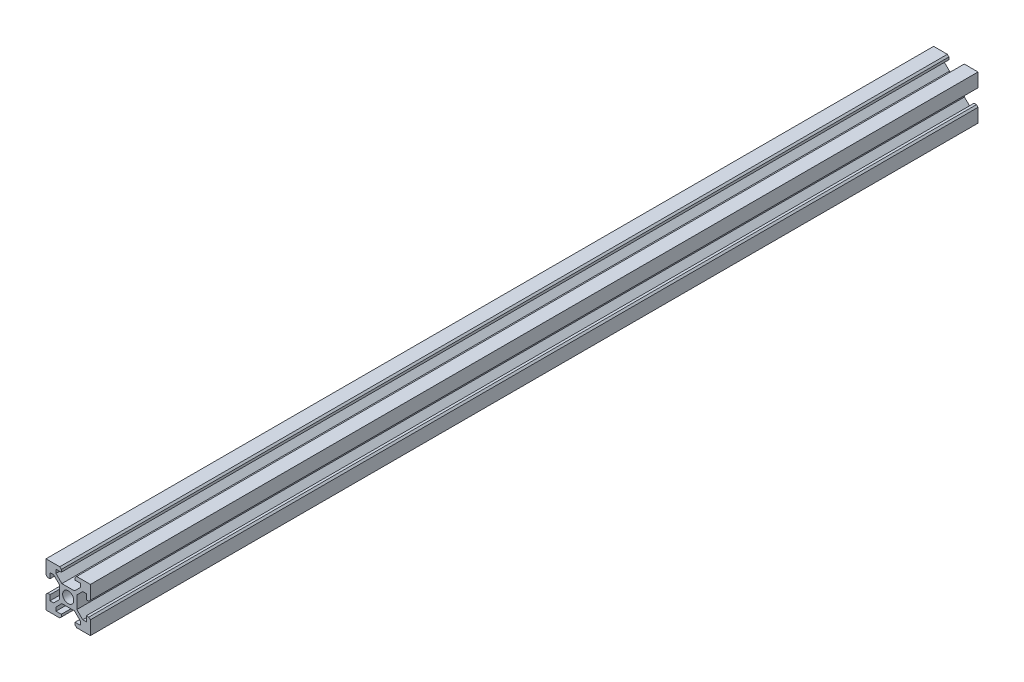
from build123d import *

# Parameters (mm, degrees)
SKETCH1_R           = 2.5
BOSS_EXTRUDE1_DEPTH = 200


with BuildPart() as part:
    # Sketch1 → Boss-Extrude1 (new, symmetric)
    with BuildSketch(Plane.XY):
        Polygon((3.9, -2.839339828), (6.560660172, -5.5), (8.200660172, -5.5), (8.200660172, -3.1), (9.3, -3.1), (10, -3.8), (10, -10), (3.8, -10), (3.1, -9.3), (3.1, -8.200660172), (5.5, -8.200660172), (5.5, -6.560660172), (2.839339828, -3.9), (-2.839339828, -3.9), (-5.5, -6.560660172), (-5.5, -8.200660172), (-3.1, -8.200660172), (-3.1, -9.3), (-3.8, -10), (-10, -10), (-10, -3.8), (-9.3, -3.1), (-8.200660172, -3.1), (-8.200660172, -5.5), (-6.560660172, -5.5), (-3.9, -2.839339828), (-3.9, 2.839339828), (-6.560660172, 5.5), (-8.200660172, 5.5), (-8.200660172, 3.1), (-9.3, 3.1), (-10, 3.8), (-10, 10), (-3.8, 10), (-3.1, 9.3), (-3.1, 8.200660172), (-5.5, 8.200660172), (-5.5, 6.560660172), (-2.839339828, 3.9), (2.839339828, 3.9), (5.5, 6.560660172), (5.5, 8.200660172), (3.1, 8.200660172), (3.1, 9.3), (3.8, 10), (10, 10), (10, 3.8), (9.3, 3.1), (8.200660172, 3.1), (8.200660172, 5.5), (6.560660172, 5.5), (3.9, 2.839339828), align=None)
        Circle(SKETCH1_R, mode=Mode.SUBTRACT)
    extrude(amount=BOSS_EXTRUDE1_DEPTH, both=True)


solid = part.part
